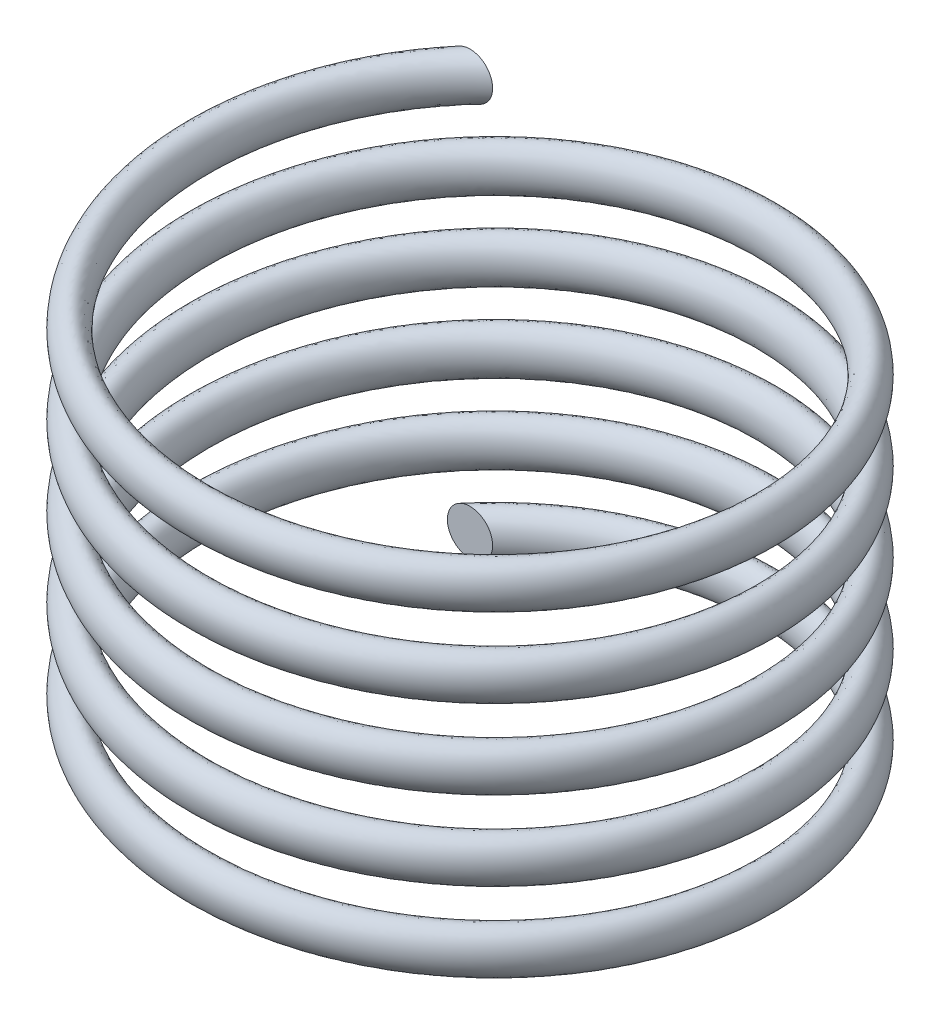
from build123d import *

# Parameters (mm, degrees)
SWEEP1_PITCH       = 7
SWEEP1_HEIGHT      = 35
SWEEP1_RADIUS      = 25
SWEEP1_START_ANGLE = -135
SKETCH3_R          = 2


with BuildPart() as part:
    # Sweep1: sweep along a helix
    with BuildLine() as sweep1_path:
        add(Helix(SWEEP1_PITCH, SWEEP1_HEIGHT, SWEEP1_RADIUS, center=(0, 0, 0), direction=(0, 1, 0), lefthand=True, mode=Mode.PRIVATE).rotate(Axis((0, 0, 0), (0, 1, 0)), SWEEP1_START_ANGLE))
    # Sketch3 → Sweep1 (sweep)
    with BuildSketch(Plane.XY.offset(-17.67766953)):
        with Locations((-17.67766953, 0)):
            Circle(SKETCH3_R)
    sweep(path=sweep1_path.line, is_frenet=True)


solid = part.part
